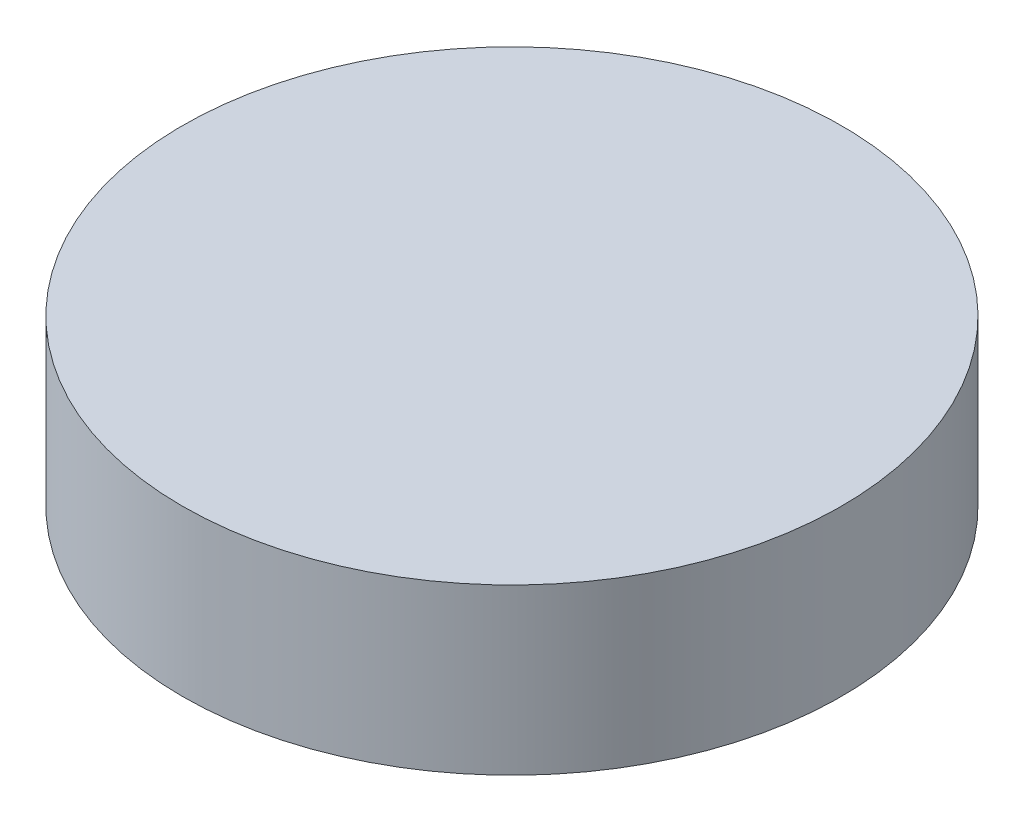
from build123d import *

# Parameters (mm, degrees)
SKETCH1_R           = 30
BOSS_EXTRUDE1_DEPTH = 15


with BuildPart() as part:
    # Sketch1 → Boss-Extrude1 (new body)
    with BuildSketch(Plane(origin=(0, 0, 0), x_dir=(1, 0, 0), z_dir=(0, 1, 0))):
        with Locations(Location((0, 0, 0), (0, 0, 270))):
            Circle(SKETCH1_R)
    extrude(amount=BOSS_EXTRUDE1_DEPTH)


solid = part.part
